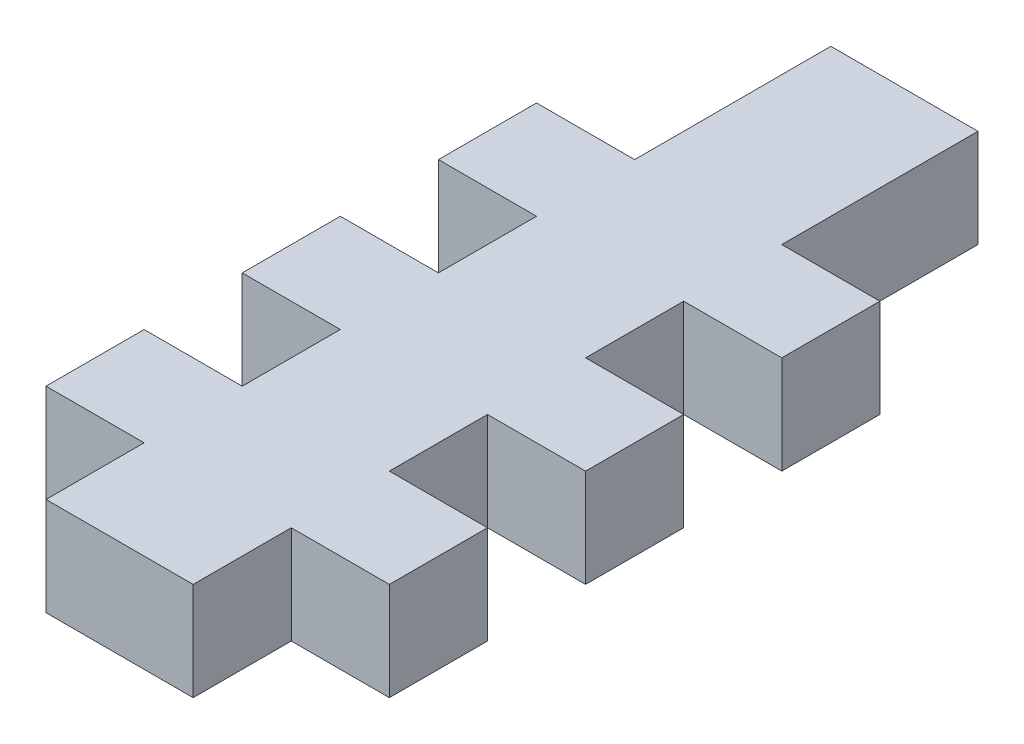
from build123d import *

# Parameters (mm, degrees)
BOSS_EXTRUDE1_DEPTH = 12.7


with BuildPart() as part:
    # Sketch1 → Boss-Extrude1 (new body)
    with BuildSketch(Plane(origin=(0, 0, 0), x_dir=(1, 0, 0), z_dir=(0, 1, 0))):
        Polygon((0, 0), (19.05, 0), (19.05, 12.7), (31.75, 12.7), (31.75, 25.4), (19.05, 25.4), (19.05, 38.1), (31.75, 38.1), (31.75, 50.8), (19.05, 50.8), (19.05, 63.5), (31.75, 63.5), (31.75, 76.2), (19.05, 76.2), (19.05, 101.6), (0, 101.6), (0, 76.2), (-12.7, 76.2), (-12.7, 63.5), (0, 63.5), (0, 50.8), (-12.7, 50.8), (-12.7, 38.1), (0, 38.1), (0, 25.4), (-12.7, 25.4), (-12.7, 12.7), (0, 12.7), align=None)
    extrude(amount=BOSS_EXTRUDE1_DEPTH)


solid = part.part
